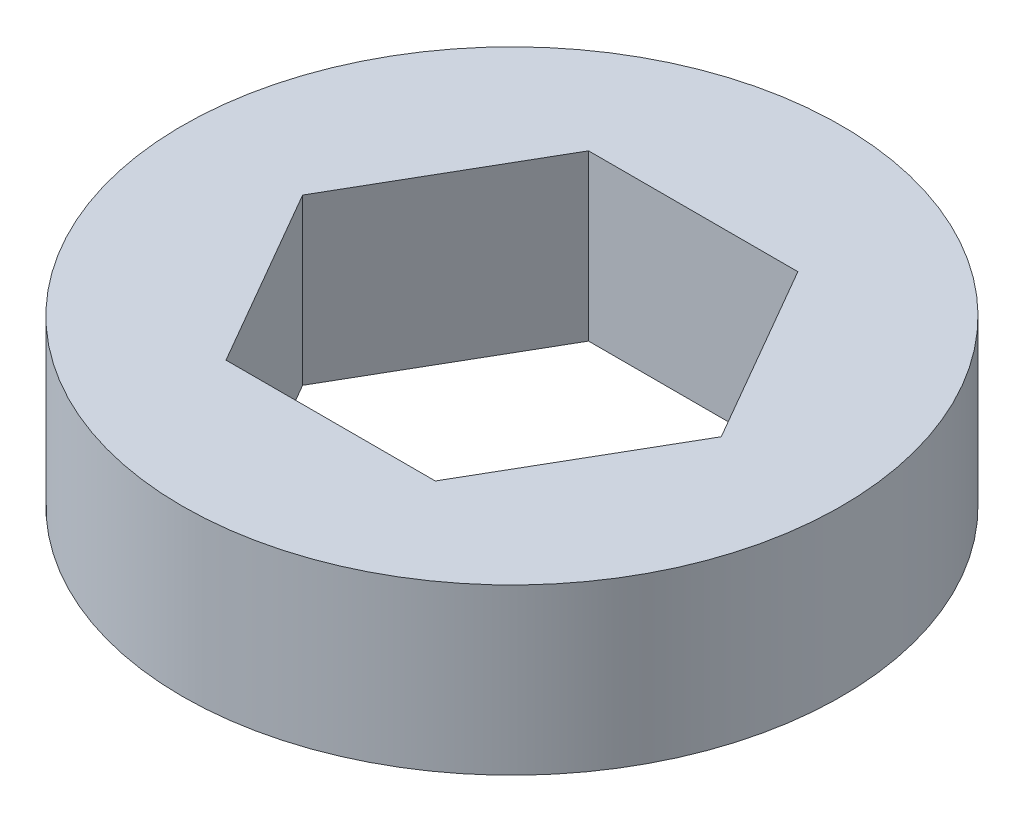
from build123d import *

# Parameters (mm, degrees)
SKETCH1_R           = 20
BOSS_EXTRUDE1_DEPTH = 10


with BuildPart() as part:
    # Sketch1 → Boss-Extrude1 (new body)
    with BuildSketch(Plane(origin=(0, 0, 0), x_dir=(1, 0, 0), z_dir=(0, 1, 0))):
        with Locations(Location((0, 0, 0), (0, 0, 270))):
            Circle(SKETCH1_R)
        Polygon((12.701705922, 0), (6.350852961, 11), (-6.350852961, 11), (-12.701705922, 0), (-6.350852961, -11), (6.350852961, -11), align=None, mode=Mode.SUBTRACT)
    extrude(amount=BOSS_EXTRUDE1_DEPTH)


solid = part.part
